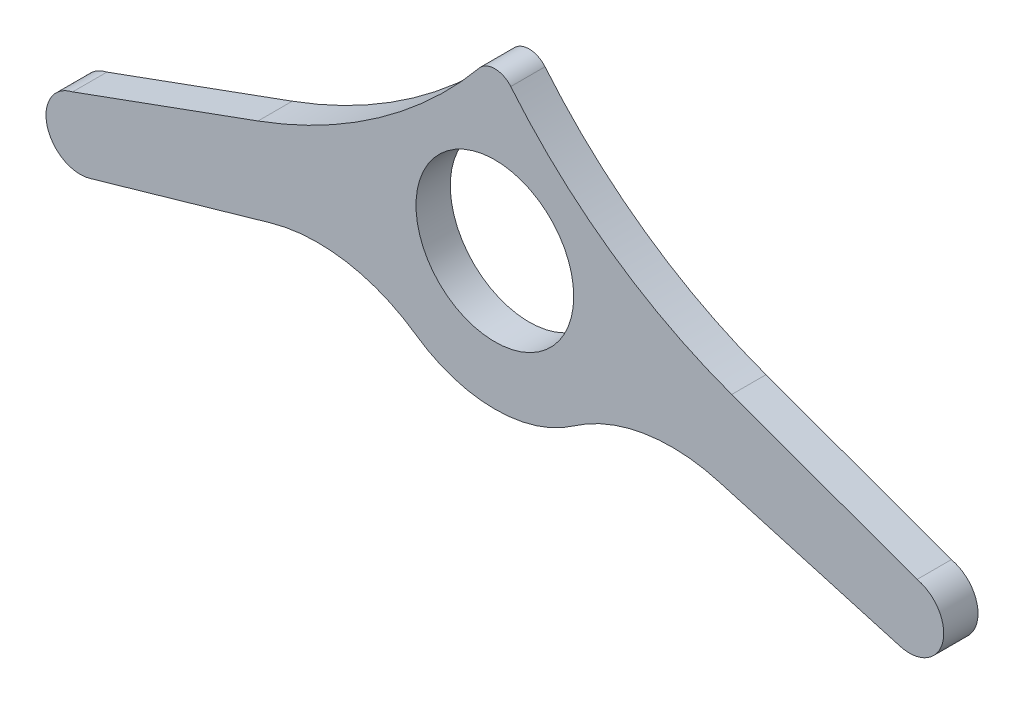
from build123d import *

# Parameters (mm, degrees)
SZKIC1_R                    = 11.5
DODANIE_WYCI_GNI_CIE1_DEPTH = 5


with BuildPart() as part:
    # Szkic1 → Dodanie-wyciągnięcie1 (new body)
    with BuildSketch(Plane.XY):
        with BuildLine():
            Line((61.575587946, -10.709667087), (34.541009179, -0.86988512))
            ThreePointArc((34.541009179, -0.86988512), (16.903048978, 8.361476253), (2.31509692, 21.907963902))
            ThreePointArc((2.31509692, 21.907963902), (0, 23), (-2.31509692, 21.907963902))
            ThreePointArc((-2.31509692, 21.907963902), (-16.903048978, 8.361476253), (-34.541009179, -0.86988512))
            Line((-34.541009179, -0.86988512), (-61.575587946, -10.709667087))
            ThreePointArc((-61.575587946, -10.709667087), (-65.300497868, -16.83130683), (-59.08055809, -20.389645799))
            Line((-59.08055809, -20.389645799), (-32.70655403, -12.827021831))
            ThreePointArc((-32.70655403, -12.827021831), (-21.687864518, -12.201686212), (-11.473608949, -16.381584102))
            ThreePointArc((-11.473608949, -16.381584102), (0, -20), (11.473608949, -16.381584102))
            ThreePointArc((11.473608949, -16.381584102), (21.687864518, -12.201686212), (32.70655403, -12.827021831))
            Line((32.70655403, -12.827021831), (59.08055809, -20.389645799))
            ThreePointArc((59.08055809, -20.389645799), (65.300497868, -16.83130683), (61.575587946, -10.709667087))
        make_face()
        Circle(SZKIC1_R, mode=Mode.SUBTRACT)
    extrude(amount=DODANIE_WYCI_GNI_CIE1_DEPTH)


solid = part.part
